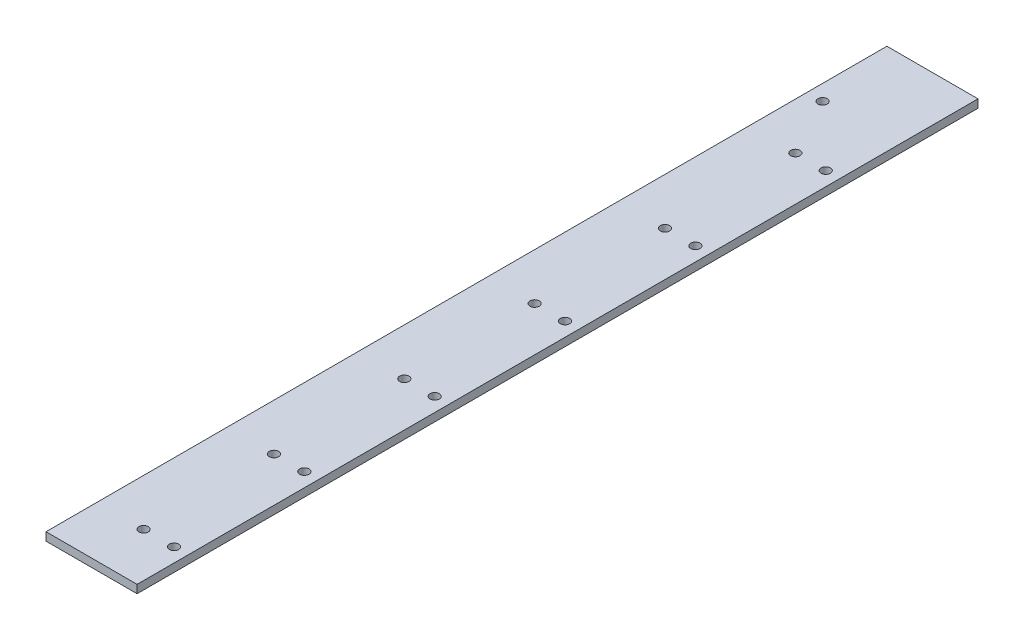
from build123d import *

# Parameters (mm, degrees)
SKETCH1_W           = 39
SKETCH1_H           = 3.5
BOSS_EXTRUDE1_DEPTH = 360
SKETCH2_R           = 2
CUT_EXTRUDE1_DEPTH  = 10
SKETCH3_R           = 2
CUT_EXTRUDE2_DEPTH  = 10
LPATTERN1_COUNT     = 6
LPATTERN1_PITCH     = 55.8


with BuildPart() as part:
    # Sketch1 → Boss-Extrude1 (new body)
    with BuildSketch(Plane.XY):
        Rectangle(SKETCH1_W, SKETCH1_H)
    extrude(amount=BOSS_EXTRUDE1_DEPTH)

    # Sketch2 → Cut-Extrude1 (cut)
    with BuildSketch(Plane(origin=(0, 1.75, 0), x_dir=(1, 0, 0), z_dir=(0, 1, 0))):
        with Locations(Location((-12.820655038, -34.224890394, 0), (0, 0, 270))):
            Circle(SKETCH2_R)
    extrude(amount=-CUT_EXTRUDE1_DEPTH, mode=Mode.SUBTRACT)

    # Sketch3 → Cut-Extrude2 (cut)
    with BuildSketch(Plane(origin=(0, 1.75, 0), x_dir=(1, 0, 0), z_dir=(0, 1, 0))):
        with Locations(Location((0.5, -59.2, 0), (0, 0, 270))):
            Circle(SKETCH3_R)
        with Locations(Location((13.5, -59.2, 0), (0, 0, 270))):
            Circle(SKETCH3_R)
    cut_extrude2 = extrude(amount=-CUT_EXTRUDE2_DEPTH, mode=Mode.SUBTRACT)

    # LPattern1: Cut-Extrude2 ×6
    with Locations(*[(0, 0, i * LPATTERN1_PITCH) for i in range(1, LPATTERN1_COUNT)]):
        add(cut_extrude2, mode=Mode.SUBTRACT)


solid = part.part
